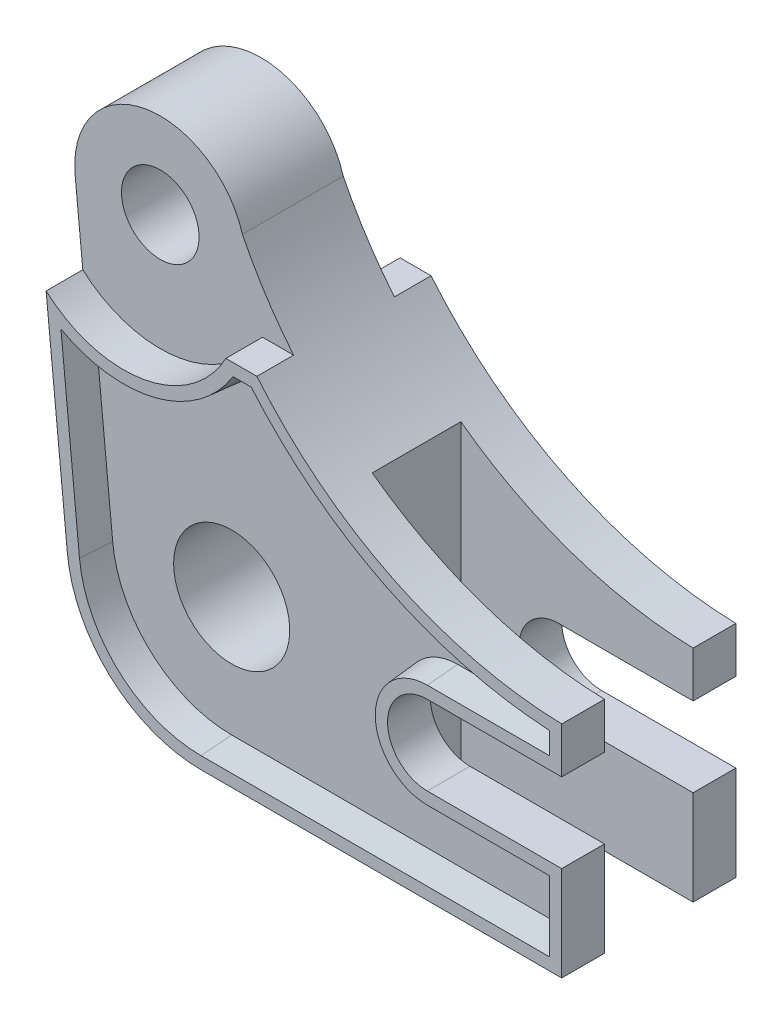
from build123d import *

# Parameters (mm, degrees)
ESQUISSE1_R             = 6.35
ESQUISSE1_R_2           = 9.5
BOSS_EXTRU_1_DEPTH      = 28.5
ENL_V_START             = -6
ENL_V_MAT_EXTRU_1_DEPTH = 6
ENL_V_MAT_EXTRU_2_DEPTH = 6
ESQUISSE4_W             = 38
ESQUISSE4_H             = 14.5
ENL_V_MAT_EXTRU_3_DEPTH = 124.584469767
ENL_V_MAT_EXTRU_5_DEPTH = 5
ENL_V_MAT_EXTRU_5_DRAFT = -5


with BuildPart() as part:
    # Esquisse1 → Boss.-Extru.1 (new body)
    with BuildSketch(Plane.XY):
        with BuildLine():
            Line((-86.633280406, -6.99307262), (-81.912918385, -55.104590809))
            ThreePointArc((-81.912918385, -55.104590809), (-74.795399572, -69.254576275), (-60.018047616, -74.956420883))
            Line((-60.018047616, -74.956420883), (-1.018047616, -74.956420883))
            Line((-1.018047616, -74.956420883), (-1.018047616, -59.456420883))
            Line((-1.018047616, -59.456420883), (-23.018047616, -59.456420883))
            ThreePointArc((-23.018047616, -59.456420883), (-29.518047616, -52.956420883), (-23.018047616, -46.456420883))
            Line((-23.018047616, -46.456420883), (-1.018047616, -46.456420883))
            Line((-1.018047616, -46.456420883), (-1.018047616, -38.956420883))
            ThreePointArc((-1.018047616, -38.956420883), (-35.318453229, -28.420111536), (-59.263146108, -1.695902984))
            ThreePointArc((-59.263146108, -1.695902984), (-75.360354059, 8.118888343), (-86.633280406, -6.99307262))
        make_face()
        with Locations(Location((-72.700180587, -5.626055331, 0), (0, 0, 180))):
            Circle(ESQUISSE1_R, mode=Mode.SUBTRACT)
        with Locations(Location((-60.018047616, -52.956420883, 0), (0, 0, 180))):
            Circle(ESQUISSE1_R_2, mode=Mode.SUBTRACT)
    extrude(amount=BOSS_EXTRU_1_DEPTH)

    # Esquisse2 → Enlèv. mat.-Extru.1 (cut)
    with BuildSketch(Plane.XY.offset(28.5).offset(ENL_V_START)):
        with BuildLine():
            Line((-50.888781824, -14.626055395), (-55.966980296, -14.626055395))
            ThreePointArc((-55.966980296, -14.626055395), (-69.422632675, -24.341227799), (-85.379019392, -19.776922952))
            Line((-85.379019392, -19.776922952), (-86.633280406, -6.99307262))
            ThreePointArc((-86.633280406, -6.99307262), (-75.360354059, 8.118888343), (-59.263146108, -1.695902984))
            ThreePointArc((-59.263146108, -1.695902984), (-55.448825079, -8.402467045), (-50.888781824, -14.626055395))
        make_face()
    extrude(amount=ENL_V_MAT_EXTRU_1_DEPTH, mode=Mode.SUBTRACT)

    # Esquisse3 → Enlèv. mat.-Extru.2 (cut)
    with BuildSketch(Plane(origin=(0, 0, 0), x_dir=(-1, 0, 0), z_dir=(0, 0, -1))):
        with BuildLine():
            Line((85.379019392, -19.776922952), (86.633280406, -6.99307262))
            ThreePointArc((86.633280406, -6.99307262), (75.360354059, 8.118888343), (59.263146108, -1.695902984))
            ThreePointArc((59.263146108, -1.695902984), (55.448825079, -8.402467045), (50.888781824, -14.626055395))
            Line((50.888781824, -14.626055395), (55.966980296, -14.626055395))
            ThreePointArc((55.966980296, -14.626055395), (69.422632675, -24.341227799), (85.379019392, -19.776922952))
        make_face()
    extrude(amount=-ENL_V_MAT_EXTRU_2_DEPTH, mode=Mode.SUBTRACT)

    # Esquisse4 → Enlèv. mat.-Extru.3 (cut, through all)
    with BuildSketch(Plane.XZ.offset(74.956420883)):
        with Locations((-20.018047616, 14.25)):
            Rectangle(ESQUISSE4_W, ESQUISSE4_H)
    extrude(amount=-ENL_V_MAT_EXTRU_3_DEPTH, mode=Mode.SUBTRACT)


with BuildPart() as enl_v_mat_extru_5_tool:
    # Esquisse5 → Enlèv. mat.-Extru.5 (with draft: the straight prism first)
    with BuildSketch(Plane.XY.offset(28.5)):
        with BuildLine():
            Line((-51.822935649, -16.626055395), (-54.811637006, -16.626055395))
            ThreePointArc((-54.811637006, -16.626055395), (-67.412845938, -25.949541557), (-82.960069876, -23.949119459))
            Line((-82.960069876, -23.949119459), (-79.922475588, -54.909302634))
            ThreePointArc((-79.922475588, -54.909302634), (-73.452003939, -67.772925785), (-60.018047616, -72.956420883))
            Line((-60.018047616, -72.956420883), (-3.018047616, -72.956420883))
            Line((-3.018047616, -72.956420883), (-3.018047616, -61.456420883))
            Line((-3.018047616, -61.456420883), (-23.018047616, -61.456420883))
            ThreePointArc((-23.018047616, -61.456420883), (-31.518047616, -52.956420883), (-23.018047616, -44.456420883))
            Line((-23.018047616, -44.456420883), (-3.018047616, -44.456420883))
            Line((-3.018047616, -44.456420883), (-3.018047616, -40.875747076))
            ThreePointArc((-3.018047616, -40.875747076), (-29.916011773, -33.773380805), (-51.822935649, -16.626055395))
        make_face()
    extrude(amount=-ENL_V_MAT_EXTRU_5_DEPTH)
    # Enlèv. mat.-Extru.5: the draft: its side faces are tilted about the plane it starts from
    enl_v_mat_extru_5_sides = [enl_v_mat_extru_5_tool.faces().sort_by_distance(p)[0] for p in [
        (-53.317286327, -16.626055395, 26),
        (-67.412845938, -25.949541557, 26),
        (-81.441272732, -39.429211046, 26),
        (-73.452003939, -67.772925785, 26),
        (-31.518047616, -72.956420883, 26),
        (-3.018047616, -67.206420883, 26),
        (-13.018047616, -61.456420883, 26),
        (-31.518047616, -52.956420883, 26),
        (-13.018047616, -44.456420883, 26),
        (-3.018047616, -42.66608398, 26),
        (-29.916011773, -33.773380805, 26),
    ]]
    draft(enl_v_mat_extru_5_sides, Plane.XY.offset(28.5), ENL_V_MAT_EXTRU_5_DRAFT)


with BuildPart() as part_1:
    add(part.part)

    # Enlèv. mat.-Extru.5: cut by enl_v_mat_extru_5_tool
    add(enl_v_mat_extru_5_tool.part, mode=Mode.SUBTRACT)


solid = part_1.part
